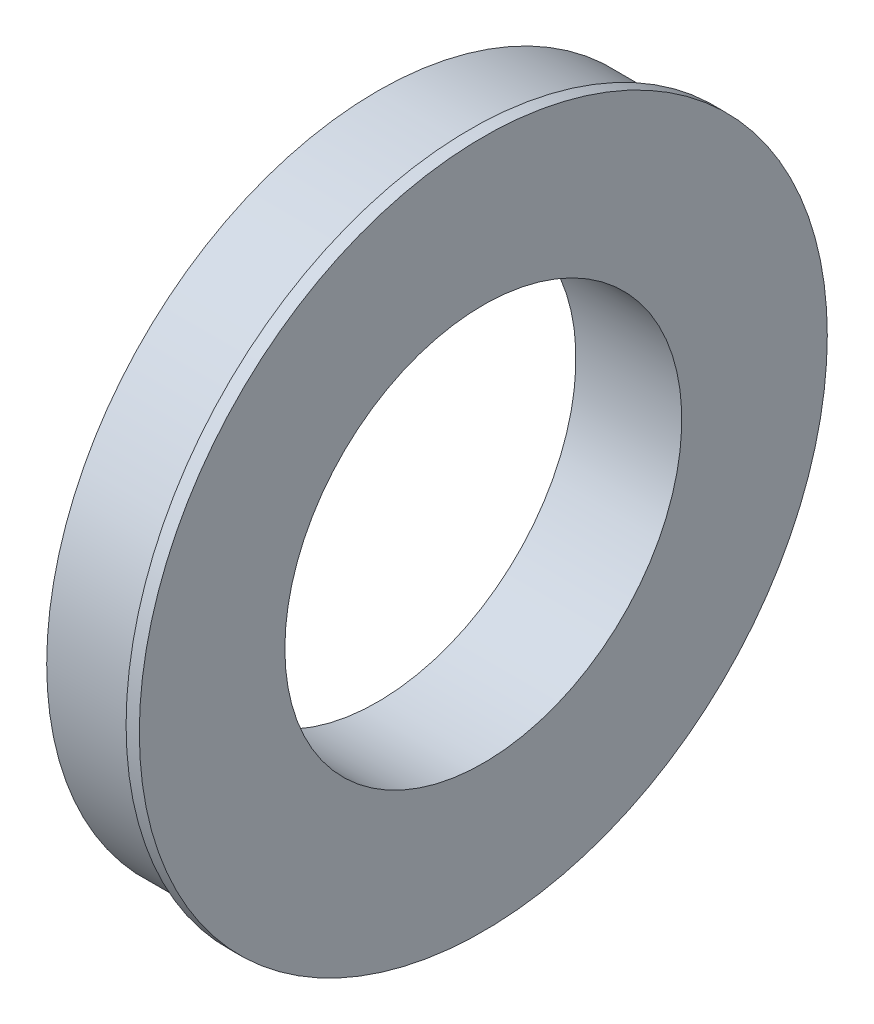
from build123d import *

# Parameters (mm, degrees)
SKETCH1_R           = 63.5
SKETCH1_R_2         = 38.1
BOSS_EXTRUDE1_DEPTH = 9.525
SKETCH2_R           = 66.04
SKETCH2_R_2         = 38.1
BOSS_EXTRUDE2_DEPTH = 1.27


with BuildPart() as part:
    # Sketch1 → Boss-Extrude1 (new, symmetric)
    with BuildSketch(Plane(origin=(0, 0, 0), x_dir=(0, 0, -1), z_dir=(1, 0, 0))):
        with Locations(Location((0, 0, 0), (0, 0, 180))):
            Circle(SKETCH1_R)
        with Locations(Location((0, 0, 0), (0, 0, 180))):
            Circle(SKETCH1_R_2, mode=Mode.SUBTRACT)
    extrude(amount=BOSS_EXTRUDE1_DEPTH, both=True)

    # Sketch2 → Boss-Extrude2 (add, symmetric)
    with BuildSketch(Plane(origin=(9.525, 0, 0), x_dir=(0, 0, -1), z_dir=(1, 0, 0))):
        Circle(SKETCH2_R)
        with Locations(Location((0, 0, 0), (0, 0, 180))):
            Circle(SKETCH2_R_2, mode=Mode.SUBTRACT)
    extrude(amount=BOSS_EXTRUDE2_DEPTH, both=True)


solid = part.part
